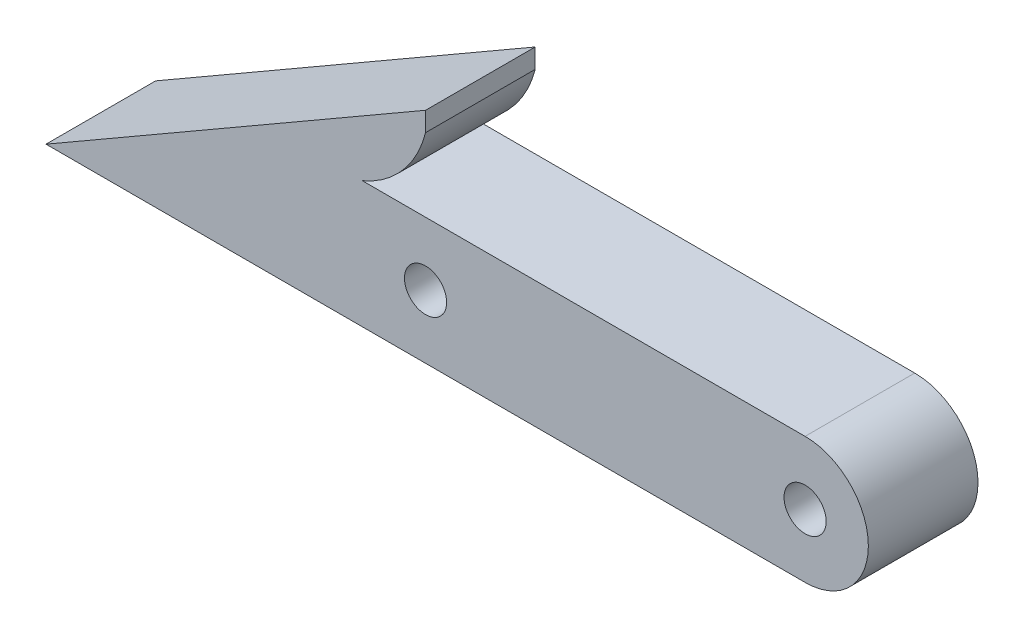
from build123d import *

# Parameters (mm, degrees)
SKETCH1_R           = 2.5
BOSS_EXTRUDE1_DEPTH = 6.5


with BuildPart() as part:
    # Sketch1 → Boss-Extrude1 (new, symmetric)
    with BuildSketch(Plane.XY):
        with BuildLine():
            ThreePointArc((22.5, -7.5), (30, 0), (22.5, 7.5))
            Line((22.5, 7.5), (-30, 7.5))
            ThreePointArc((-30, 7.5), (-25.225001549, 10.954803468), (-22.5, 16.180762114))
            Line((-22.5, 16.180762114), (-22.5, 18.480762114))
            Line((-22.5, 18.480762114), (-67.5, -7.5))
            Line((-67.5, -7.5), (22.5, -7.5))
        make_face()
        with Locations((-22.5, 0)):
            Circle(SKETCH1_R, mode=Mode.SUBTRACT)
        with Locations((22.5, 0)):
            Circle(SKETCH1_R, mode=Mode.SUBTRACT)
    extrude(amount=BOSS_EXTRUDE1_DEPTH, both=True)


solid = part.part
